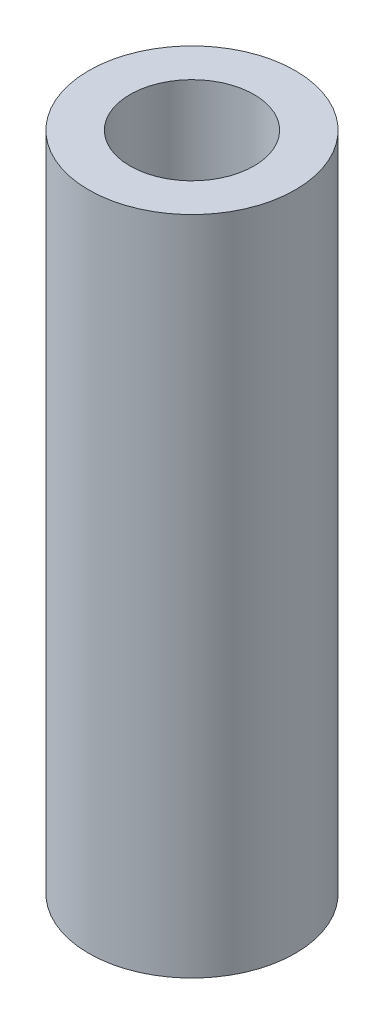
from build123d import *

# Parameters (mm, degrees)
SKETCH1_R           = 7.9375
BOSS_EXTRUDE1_DEPTH = 50.8
SKETCH1_3_R         = 4.7625
CUT_EXTRUDE1_DEPTH  = 44.45


with BuildPart() as part:
    # Sketch1 → Boss-Extrude1 (new body)
    with BuildSketch(Plane(origin=(0, 0, 0), x_dir=(1, 0, 0), z_dir=(0, 1, 0))):
        with Locations(Location((0, 0, 0), (0, 0, 270))):
            Circle(SKETCH1_R)
    extrude(amount=-BOSS_EXTRUDE1_DEPTH)

    # Sketch1<3> → Cut-Extrude1 (cut)
    with BuildSketch(Plane(origin=(0, 0, 0), x_dir=(1, 0, 0), z_dir=(0, 1, 0))):
        with Locations(Location((0, 0, 0), (0, 0, 270))):
            Circle(SKETCH1_3_R)
    extrude(amount=-CUT_EXTRUDE1_DEPTH, mode=Mode.SUBTRACT)


solid = part.part
